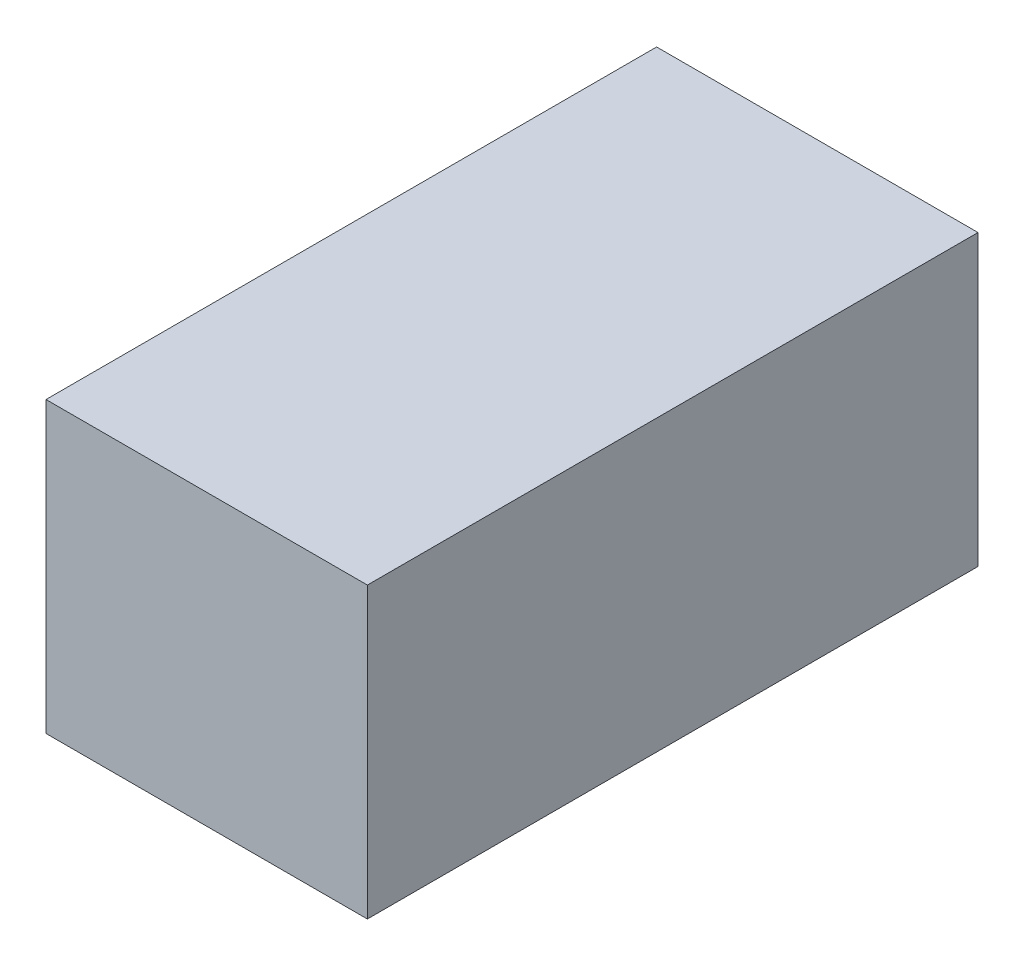
from build123d import *

# Parameters (mm, degrees)
SKETCH1_W           = 50
SKETCH1_H           = 95
BOSS_EXTRUDE1_DEPTH = 45
SKETCH2_R           = 20
CUT_EXTRUDE1_DEPTH  = 5


with BuildPart() as part:
    # Sketch1 → Boss-Extrude1 (new body)
    with BuildSketch(Plane(origin=(0, 0, 0), x_dir=(1, 0, 0), z_dir=(0, 1, 0))):
        Rectangle(SKETCH1_W, SKETCH1_H)
    extrude(amount=BOSS_EXTRUDE1_DEPTH)

    # Sketch2 → Cut-Extrude1 (cut)
    with BuildSketch(Plane(origin=(0, 0, -47.5), x_dir=(-1, 0, 0), z_dir=(0, 0, -1))):
        with Locations((0, 22.5)):
            Circle(SKETCH2_R)
    extrude(amount=-CUT_EXTRUDE1_DEPTH, mode=Mode.SUBTRACT)


solid = part.part
